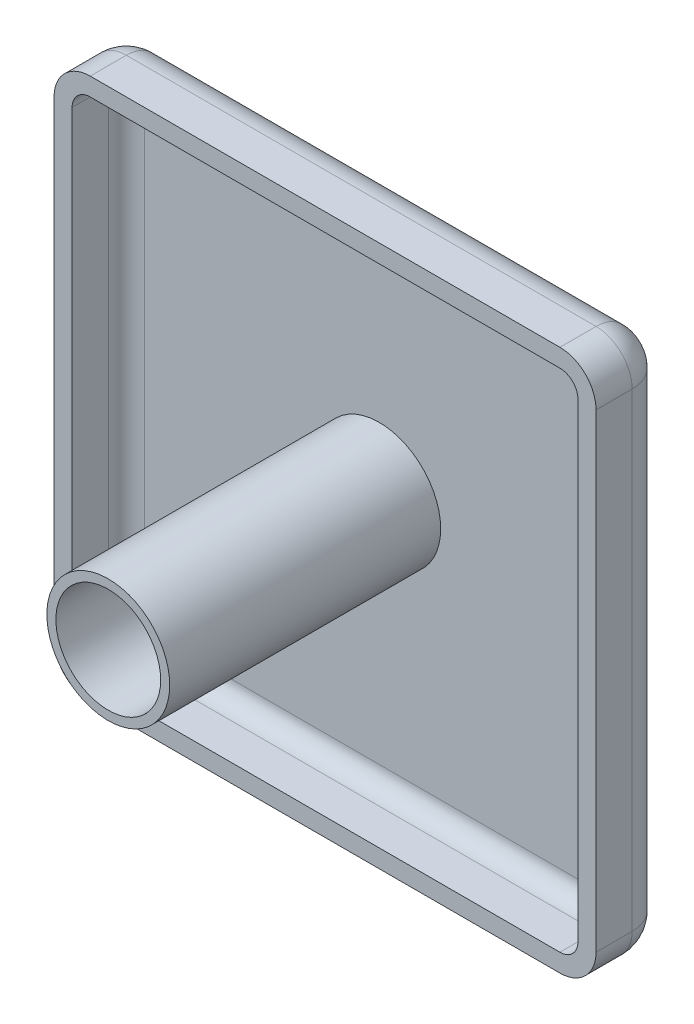
from build123d import *

# Parameters (mm, degrees)
SKETCH_1_W          = 30
SKETCH_1_H          = 30
EXTRUDE_1_DEPTH     = 4
FILLET_1_R          = 2
SHELL_1_T           = -1
SKETCH_2_R          = 3.4
EXTRUDE_2_DEPTH     = 15
SKETCH_3_R          = 2.9
CUT_EXTRUDE_1_DEPTH = 15


with BuildPart() as part:
    # 草图1 → 凸台-拉伸1 (new body)
    with BuildSketch(Plane.XY):
        Rectangle(SKETCH_1_W, SKETCH_1_H)
    extrude(amount=EXTRUDE_1_DEPTH)

    # 圆角1
    fillet_1_edges = [part.edges().sort_by_distance(p)[0] for p in [
        (0, -15, 0),
        (-15, 0, 0),
        (0, 15, 0),
        (15, 0, 0),
        (15, -15, 2),
        (-15, -15, 2),
        (-15, 15, 2),
        (15, 15, 2),
    ]]
    fillet(fillet_1_edges, radius=FILLET_1_R)

    # 抽壳1
    shell_1_openings = [part.faces().sort_by_distance(p)[0] for p in [
        (0, 0, 4),
    ]]
    offset(amount=SHELL_1_T, openings=shell_1_openings, kind=Kind.INTERSECTION)

    # 草图2 → 凸台-拉伸2 (add)
    with BuildSketch(Plane.XY.offset(1)):
        Circle(SKETCH_2_R)
    extrude(amount=EXTRUDE_2_DEPTH)

    # 草图3 → 切除-拉伸1 (cut)
    with BuildSketch(Plane.XY.offset(16)):
        Circle(SKETCH_3_R)
    extrude(amount=-CUT_EXTRUDE_1_DEPTH, mode=Mode.SUBTRACT)


solid = part.part
